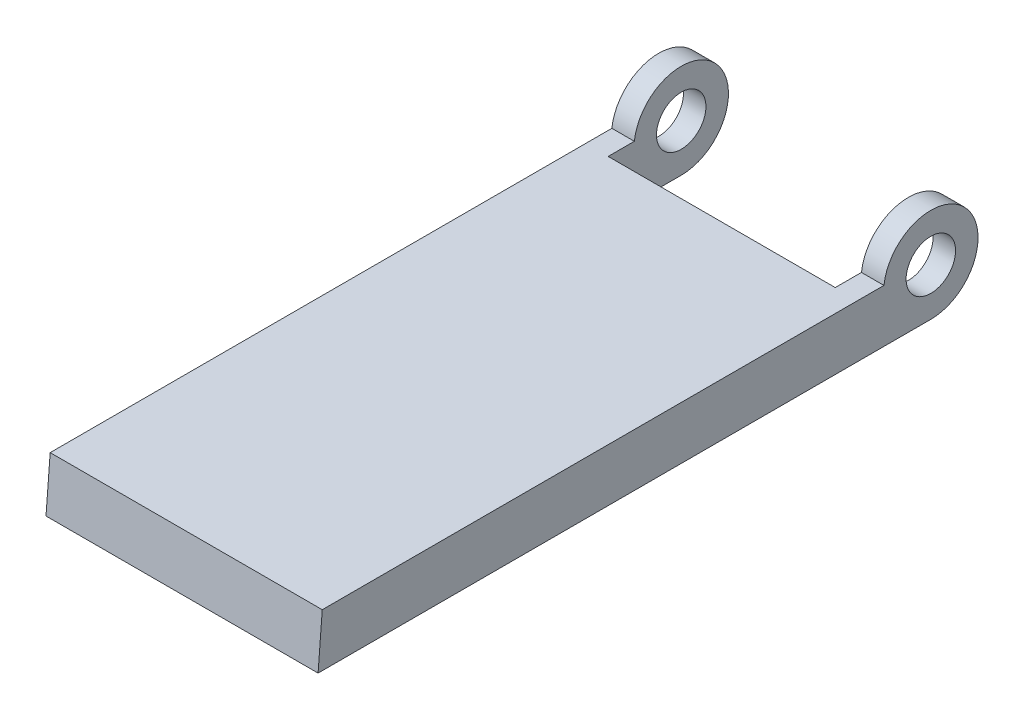
from build123d import *

# Parameters (mm, degrees)
SKETCH_1_W          = 20.2
SKETCH_1_H          = 30
EXTRUDE_1_DEPTH     = 2
SKETCH_2_R          = 4.2
SKETCH_2_R_2        = 2.2
EXTRUDE_2_DEPTH     = 2
EXTRUDE_3_DEPTH     = 2
CUT_EXTRUDE_1_REACH = 39.616
SKETCH_4_W          = 20.2
SKETCH_4_H          = 4
EXTRUDE_4_DEPTH     = 24.2
EXTRUDE_5_DEPTH     = 20.2
EXTRUDE_6_REACH     = 64.436
CUT_EXTRUDE_2_DEPTH = 20.2
CUT_EXTRUDE_3_REACH = 64.436


with BuildPart() as part:
    # 草图1 → 凸台-拉伸1 (new body)
    with BuildSketch(Plane(origin=(0, 0, 0), x_dir=(1, 0, 0), z_dir=(0, 1, 0))):
        with Locations((10.1, -15)):
            Rectangle(SKETCH_1_W, SKETCH_1_H)
    extrude(amount=EXTRUDE_1_DEPTH)

    # 草图2 → 凸台-拉伸2 (add)
    with BuildSketch(Plane.ZY):
        with Locations(Location((-2.5, 1.5, 0), (0, 0, 339.075167572))):
            Circle(SKETCH_2_R)
        with Locations((-2.5, 1.5)):
            Circle(SKETCH_2_R_2, mode=Mode.SUBTRACT)
    extrude_2 = extrude(amount=EXTRUDE_2_DEPTH)

    # 草图3 → 凸台-拉伸3 (add)
    with BuildSketch(Plane.ZY):
        with BuildLine():
            Line((1.423009049, 0), (30, 0))
            Line((30, 0), (30, 2))
            Line((30, 2), (1.670131892, 2))
            ThreePointArc((1.670131892, 2), (1.668300922, 0.984958812), (1.423009049, 0))
        make_face()
    extrude_3 = extrude(amount=EXTRUDE_3_DEPTH)

    # 镜向1: 凸台-拉伸2, 凸台-拉伸3 across plane
    add(extrude_2.mirror(Plane(origin=(10.1, 0, 0), x_dir=(0, 0, 1), z_dir=(1, 0, 0))))
    add(extrude_3.mirror(Plane(origin=(10.1, 0, 0), x_dir=(0, 0, 1), z_dir=(1, 0, 0))))

    # 草图4 → 切除-拉伸1 (cut, up to next)
    with BuildSketch(Plane(origin=(0, 2, 0), x_dir=(1, 0, 0), z_dir=(0, 1, 0)), mode=Mode.PRIVATE) as cut_extrude_1_sk1:
        with Locations((10.1, -2)):
            Rectangle(SKETCH_4_W, SKETCH_4_H)
    cut_extrude_1_tool1 = extrude(cut_extrude_1_sk1.sketch, amount=-CUT_EXTRUDE_1_REACH, mode=Mode.PRIVATE) & part.part
    add(cut_extrude_1_tool1.solids().sort_by_distance((10.1, 2, 2))[0], mode=Mode.SUBTRACT)

    # 草图7 → 凸台-拉伸4 (add)
    with BuildSketch(Plane.ZY.offset(2)):
        Polygon((30, 0), (56.65925637, 0), (57.272485309, 2), (30, 2), align=None)
    extrude(amount=-EXTRUDE_4_DEPTH)

    # 草图8 → 凸台-拉伸5 (add)
    with BuildSketch(Plane.ZY.offset(-20.2)):
        Polygon((4, 2), (3.386771061, 0), (4, 0), align=None)
    extrude(amount=EXTRUDE_5_DEPTH)

    # 凸台-拉伸6: up to this face of the body (flat: up to its plane)
    extrude_6_end = Plane(part.part.faces().sort_by_distance((22.2, 1.134069843, 20.823377478))[0])
    # 草图10 → 凸台-拉伸6 (add, up to the picked face)
    with BuildSketch(Plane.ZY.offset(2), mode=Mode.PRIVATE) as extrude_6_sk1:
        with BuildLine():
            Line((56.65925637, 0), (55.831397303, -2.7))
            Line((55.831397303, -2.7), (-2.5, -2.7))
            ThreePointArc((-2.5, -2.7), (-0.11882382, -1.959768778), (1.423009049, 0))
            Line((1.423009049, 0), (56.65925637, 0))
        make_face()
    extrude_6_tool1 = split(extrude(extrude_6_sk1.sketch, amount=-EXTRUDE_6_REACH, mode=Mode.PRIVATE), bisect_by=extrude_6_end, keep=Keep.BOTH, mode=Mode.PRIVATE)
    add(extrude_6_tool1.solids().sort_by(Axis((-2, -1.358557, 28.290322), (1, 0, 0)))[0])

    # 草图11 → 切除-拉伸2 (cut)
    with BuildSketch(Plane.ZY.offset(-20.2)):
        Polygon((3.386771061, 0), (2.558911994, -2.7), (-2.5, -2.7), (1.423009049, 0), align=None)
    extrude(amount=CUT_EXTRUDE_2_DEPTH, mode=Mode.SUBTRACT)

    # 草图15 → 切除-拉伸3 (cut, up to next)
    with BuildSketch(Plane.ZY.offset(2), mode=Mode.PRIVATE) as cut_extrude_3_sk1:
        Polygon((51.628649906, 2), (51.999830908, -2.7), (55.831397303, -2.7), (57.272485309, 2), align=None)
    cut_extrude_3_tool1 = extrude(cut_extrude_3_sk1.sketch, amount=-CUT_EXTRUDE_3_REACH, mode=Mode.PRIVATE) & part.part
    add(cut_extrude_3_tool1.solids().sort_by_distance((-2, -0.200179, 54.200143))[0], mode=Mode.SUBTRACT)


solid = part.part
